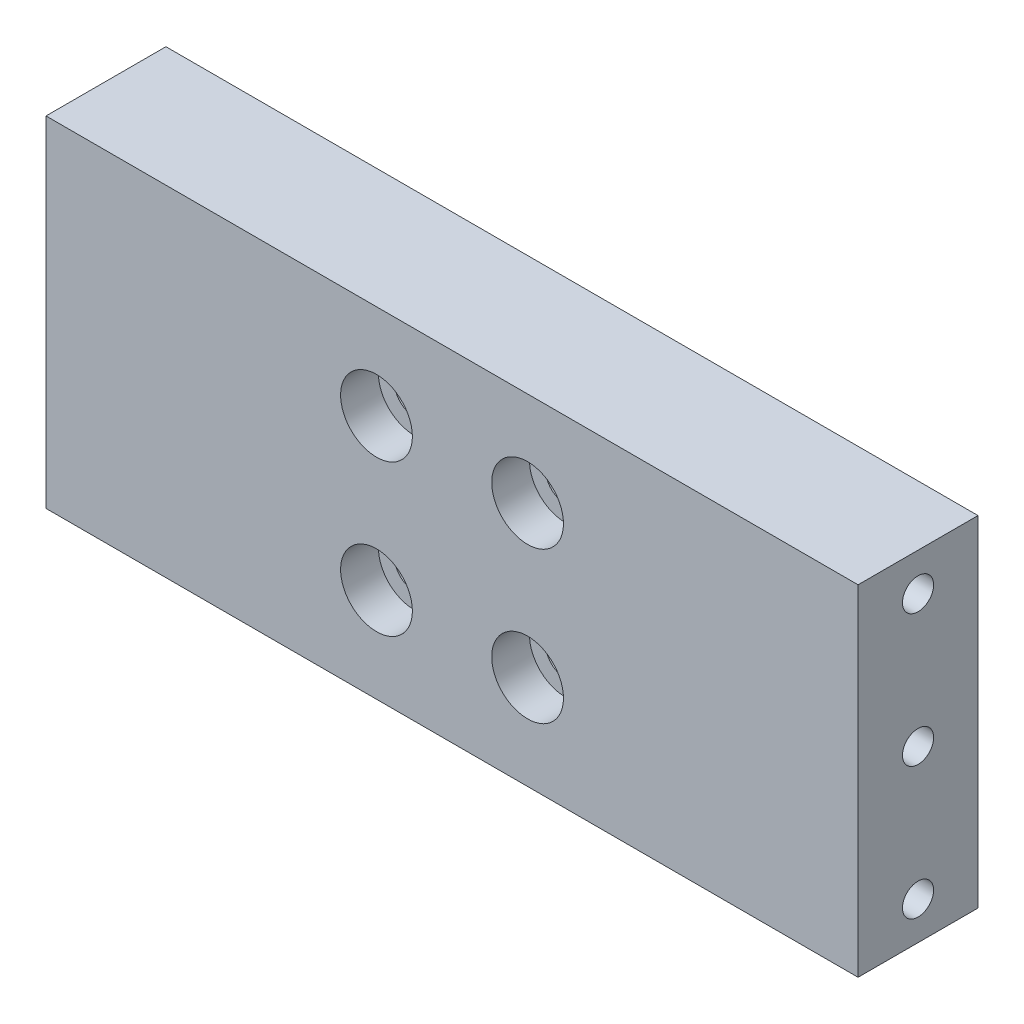
from build123d import *

# Parameters (mm, degrees)
SKETCH1_W                                    = 86
SKETCH1_H                                    = 36
BOSS_EXTRUDE1_DEPTH                          = 6.35
CBORE_FOR_M4_HEX_HEAD_CAP_SCREW2_D           = 4.2
CBORE_FOR_M4_HEX_HEAD_CAP_SCREW2_CBORE_D     = 7.6
CBORE_FOR_M4_HEX_HEAD_CAP_SCREW2_CBORE_DEPTH = 4
SKETCH6_R                                    = 1.65
CUT_EXTRUDE1_DEPTH                           = 10


with BuildPart() as part:
    # Sketch1 → Boss-Extrude1 (new, symmetric)
    with BuildSketch(Plane.XY):
        Rectangle(SKETCH1_W, SKETCH1_H)
    extrude(amount=BOSS_EXTRUDE1_DEPTH, both=True)

    # CBORE for M4 Hex Head Cap Screw2 (through all)
    with Locations(Plane(origin=(-8, 8, 6.35), x_dir=(1, 0, 0), z_dir=(0, 0, 1))):
        with Locations((0, 0), (0, -16), (16, -16), (16, 0)):
            CounterBoreHole(CBORE_FOR_M4_HEX_HEAD_CAP_SCREW2_D / 2, CBORE_FOR_M4_HEX_HEAD_CAP_SCREW2_CBORE_D / 2, CBORE_FOR_M4_HEX_HEAD_CAP_SCREW2_CBORE_DEPTH)

    # Sketch6 → Cut-Extrude1 (cut)
    with BuildSketch(Plane.ZY.offset(43)):
        with Locations(Location((0, 14, 0), (0, 0, 270))):
            Circle(SKETCH6_R)
        with Locations(Location((0, -14, 0), (0, 0, 270))):
            Circle(SKETCH6_R)
        with Locations(Location((0, 0, 0), (0, 0, 270))):
            Circle(SKETCH6_R)
    cut_extrude1 = extrude(amount=-CUT_EXTRUDE1_DEPTH, mode=Mode.SUBTRACT)

    # Mirror1: Cut-Extrude1 across plane
    add(cut_extrude1.mirror(Plane(origin=(0, 0, 0), x_dir=(0, 0, 1), z_dir=(1, 0, 0))), mode=Mode.SUBTRACT)


solid = part.part
